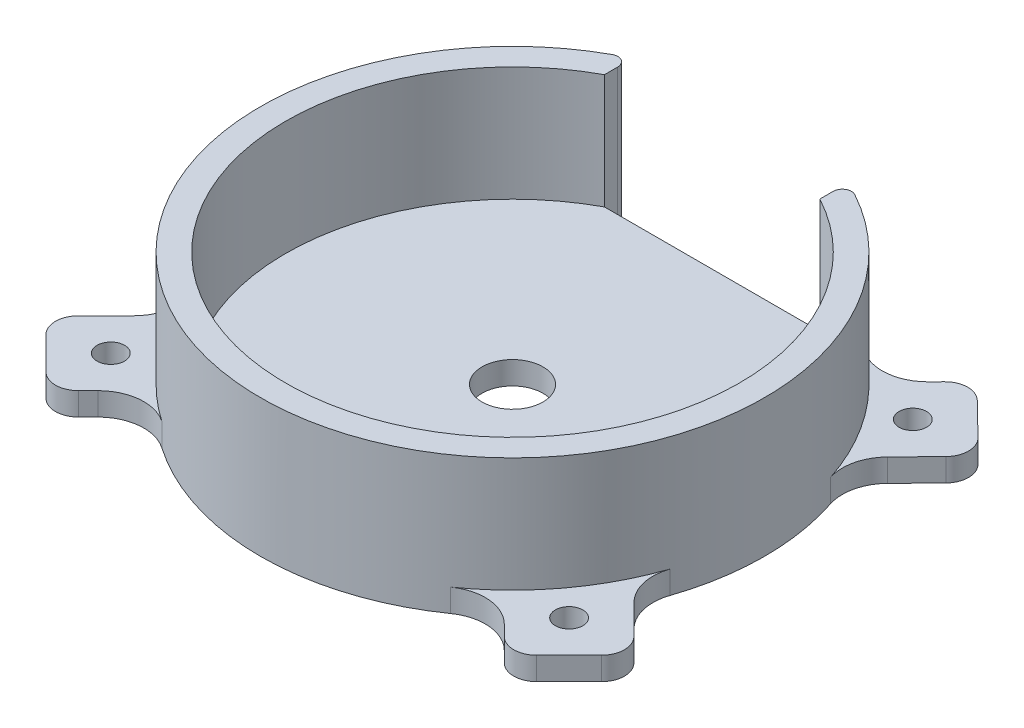
from build123d import *

# Parameters (mm, degrees)
SKETCH_1_R          = 55
EXTRUDE_1_DEPTH     = 30
SKETCH_3_R          = 49.5
CUT_EXTRUDE_1_DEPTH = 25
SKETCH_5_W          = 47
SKETCH_5_H          = 12.24289715
CUT_EXTRUDE_2_DEPTH = 30
FILLET_4_R          = 2
FILLET_5_R          = 2
SKETCH_6_R          = 6.65
CUT_EXTRUDE_3_DEPTH = 12
EXTRUDE_START       = -5
EXTRUDE_3_DEPTH     = 5
FILLET_7_R          = 10
FILLET_8_R          = 5
SKETCH_10_R         = 3
CUT_EXTRUDE_5_DEPTH = 5


with BuildPart() as part:
    # 草图1 → 凸台-拉伸1 (new body)
    with BuildSketch(Plane(origin=(0, 0, 0), x_dir=(1, 0, 0), z_dir=(0, 1, 0))):
        with Locations(Location((0, 0, 0), (0, 0, 270))):
            Circle(SKETCH_1_R)
    extrude(amount=EXTRUDE_1_DEPTH)

    # 草图3 → 切除-拉伸1 (cut)
    with BuildSketch(Plane(origin=(0, 30, 0), x_dir=(1, 0, 0), z_dir=(0, 1, 0))):
        with Locations(Location((0, 0, 0), (0, 0, 270))):
            Circle(SKETCH_3_R)
    extrude(amount=-CUT_EXTRUDE_1_DEPTH, mode=Mode.SUBTRACT)

    # 草图5 → 切除-拉伸2 (cut)
    with BuildSketch(Plane(origin=(0, 30, 0), x_dir=(1, 0, 0), z_dir=(0, 1, 0))):
        with Locations((0, 49.687490397)):
            Rectangle(SKETCH_5_W, SKETCH_5_H)
    extrude(amount=-CUT_EXTRUDE_2_DEPTH, mode=Mode.SUBTRACT)

    # 圆角4
    fillet_4_edges = [part.edges().sort_by_distance(p)[0] for p in [
        (-23.5, 15, -49.726753363),
    ]]
    fillet(fillet_4_edges, radius=FILLET_4_R)

    # 圆角5
    fillet_5_edges = [part.edges().sort_by_distance(p)[0] for p in [
        (23.5, 15, -49.726753363),
    ]]
    fillet(fillet_5_edges, radius=FILLET_5_R)

    # 草图6 → 切除-拉伸3 (cut)
    with BuildSketch(Plane(origin=(0, 5, 0), x_dir=(1, 0, 0), z_dir=(0, 1, 0))):
        with Locations(Location((0, 0, 0), (0, 0, 270))):
            Circle(SKETCH_6_R)
    extrude(amount=-CUT_EXTRUDE_3_DEPTH, mode=Mode.SUBTRACT)

    # 草图14 → 凸台-拉伸3 (add)
    with BuildSketch(Plane(origin=(0, 5, 0), x_dir=(1, 0, 0), z_dir=(0, 1, 0)).offset(EXTRUDE_START)):
        with BuildLine():
            Line((-49.898576095, 23.132922507), (-63.862525635, 37.044772973))
            Line((-63.862525635, 37.044772973), (-49.746845912, 51.213315099))
            Line((-49.746845912, 51.213315099), (-38.128637352, 39.638453724))
            ThreePointArc((-38.128637352, 39.638453724), (-44.78063998, 31.932652301), (-49.898576095, 23.132922507))
        make_face()
        with BuildLine():
            Line((49.811900188, -23.3189751), (64.421720913, -37.928795825))
            Line((64.421720913, -37.928795825), (50.279585289, -52.070931449))
            Line((50.279585289, -52.070931449), (37.984884655, -39.776230814))
            ThreePointArc((37.984884655, -39.776230814), (44.662950793, -32.097053236), (49.811900188, -23.3189751))
        make_face()
        with BuildLine():
            Line((-49.632393674, -23.698639164), (-63.862550335, -37.928795825))
            Line((-63.862550335, -37.928795825), (-49.720414711, -52.070931449))
            Line((-49.720414711, -52.070931449), (-37.697852746, -40.048369484))
            ThreePointArc((-37.697852746, -40.048369484), (-44.423770724, -32.427281642), (-49.632393674, -23.698639164))
        make_face()
        with BuildLine():
            Line((38.475737251, 39.301623923), (50.118901666, 51.212426922))
            Line((50.118901666, 51.212426922), (64.420808036, 37.231887798))
            Line((64.420808036, 37.231887798), (50.134465219, 22.6171483))
            ThreePointArc((50.134465219, 22.6171483), (45.083643676, 31.50341367), (38.475737251, 39.301623923))
        make_face()
    extrude(amount=EXTRUDE_3_DEPTH)

    # 圆角7
    fillet_7_edges = [part.edges().sort_by_distance(p)[0] for p in [
        (-38.128637352, 2.5, -39.638453724),
        (-49.898576095, 2.5, -23.132922507),
        (-49.632393674, 2.5, 23.698639164),
        (-37.697852746, 2.5, 40.048369484),
        (50.134465219, 2.5, -22.6171483),
        (38.475737251, 2.5, -39.301623923),
        (37.984884655, 2.5, 39.776230814),
        (49.811900188, 2.5, 23.3189751),
    ]]
    fillet(fillet_7_edges, radius=FILLET_7_R)

    # 圆角8
    fillet_8_edges = [part.edges().sort_by_distance(p)[0] for p in [
        (-63.862525635, 2.5, -37.044772973),
        (-49.746845912, 2.5, -51.213315099),
        (-49.720414711, 2.5, 52.070931449),
        (-63.862550335, 2.5, 37.928795825),
        (50.118901666, 2.5, -51.212426922),
        (64.420808036, 2.5, -37.231887798),
        (50.279585289, 2.5, 52.070931449),
        (64.421720913, 2.5, 37.928795825),
    ]]
    fillet(fillet_8_edges, radius=FILLET_8_R)

    # 草图10 → 切除-拉伸5 (cut)
    with BuildSketch(Plane(origin=(0, 5, 0), x_dir=(1, 0, 0), z_dir=(0, 1, 0))):
        with Locations(Location((-49.720414711, 37.071204175, 0), (0, 0, 270))):
            Circle(SKETCH_10_R)
        with Locations(Location((50.279585289, 37.071204175, 0), (0, 0, 270))):
            Circle(SKETCH_10_R)
        with Locations(Location((-49.720414711, -37.928795825, 0), (0, 0, 270))):
            Circle(SKETCH_10_R)
        with Locations(Location((50.279585289, -37.928795825, 0), (0, 0, 270))):
            Circle(SKETCH_10_R)
    extrude(amount=-CUT_EXTRUDE_5_DEPTH, mode=Mode.SUBTRACT)


solid = part.part
